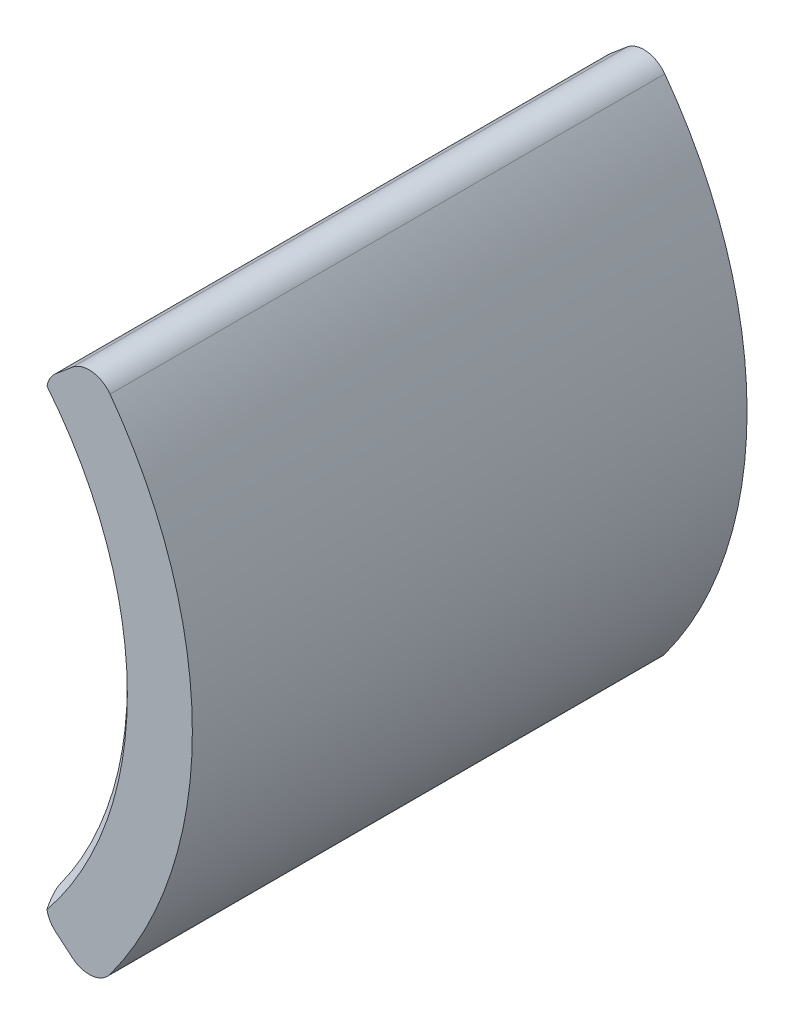
from build123d import *

# Parameters (mm, degrees)
EXTRUSION1_DEPTH = 64
CHANFREIN1_SIZE  = 1
CONG_1_R         = 3


with BuildPart() as part:
    # Esquisse1 → Extrusion1 (new body)
    with BuildSketch(Plane.XY):
        with BuildLine():
            Line((49, 0), (40.5, 0))
            ThreePointArc((40.5, 0), (38.05755114182933, 13.851815804689483), (31.024799946318748, 26.032898192304682))
            Line((31.024799946318748, 26.032898192304682), (37.53617771283009, 31.496592874640232))
            ThreePointArc((37.53617771283009, 31.496592874640232), (46.04493841850956, 16.758987022957648), (49, 0))
        make_face()
    extrusion1 = extrude(amount=EXTRUSION1_DEPTH)

    # Symétrie1: Extrusion1 across plane
    add(extrusion1.mirror(Plane(origin=(49, 0, 64), x_dir=(0, 0, 1), z_dir=(0, 1, 0))))

    # Chanfrein1
    chanfrein1_edges = [part.edges().sort_by_distance(p)[0] for p in [
        (40.50000000000001, 3.55e-15, 64),
        (40.50000000000001, -3.55e-15, 0),
    ]]
    chamfer(chanfrein1_edges, length=CHANFREIN1_SIZE)

    # Congé1
    cong_1_edges = [part.edges().sort_by_distance(p)[0] for p in [
        (31.02479994631875, 26.032898192304682, 32),
        (37.536177712830096, 31.496592874640232, 32),
        (37.536177712830096, -31.496592874640232, 32),
        (31.02479994631875, -26.032898192304682, 32),
    ]]
    fillet(cong_1_edges, radius=CONG_1_R)


solid = part.part
